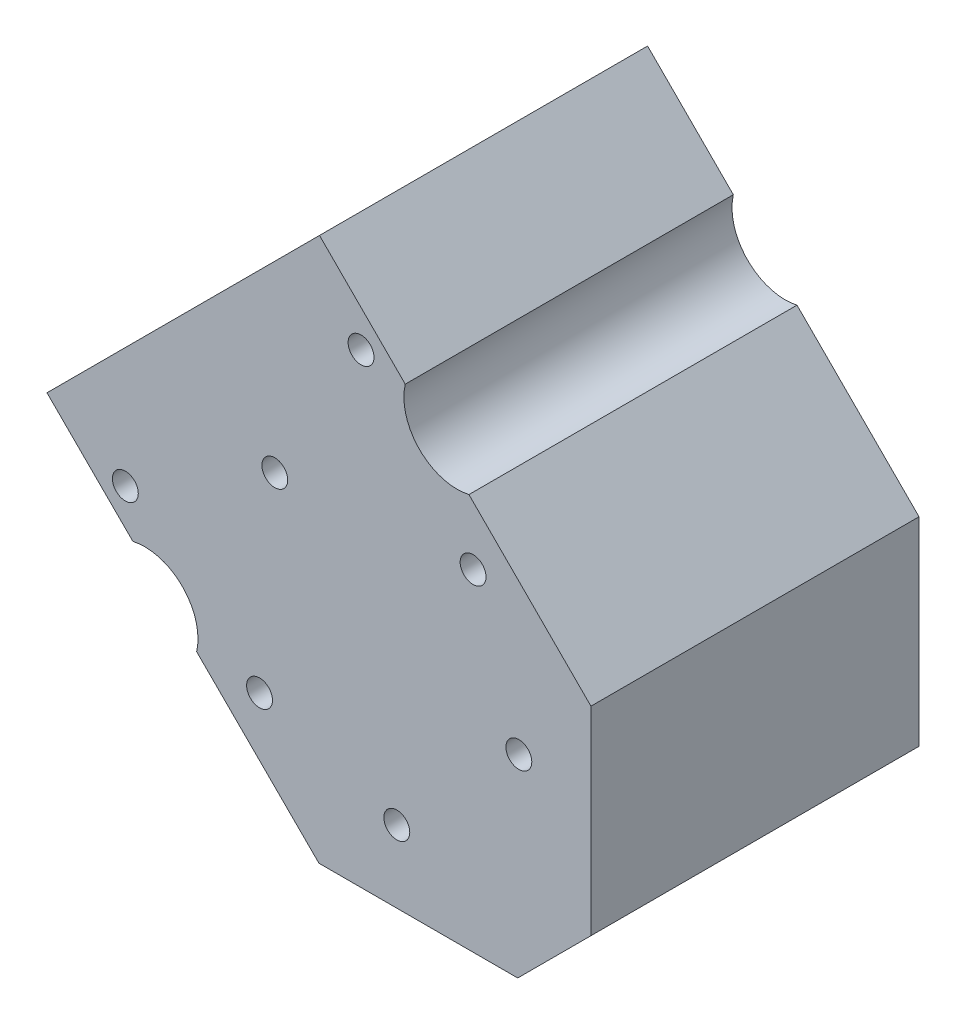
from build123d import *

# Parameters (mm, degrees)
BOSS_EXTRUDE1_DEPTH = 38.0226
SKETCH4_R           = 1.5
CUT_EXTRUDE2_DEPTH  = 133.893603459


with BuildPart() as part:
    # Sketch1 → Boss-Extrude1 (new body)
    with BuildSketch(Plane.XY):
        with BuildLine():
            Line((-58.458365937, 90.041634063), (-90.041634063, 58.458365937))
            Line((-90.041634063, 58.458365937), (-80.085733054, 48.520837101))
            ThreePointArc((-80.085733054, 48.520837101), (-74.352118178, 46.871638295), (-72.692331868, 41.141079365))
            Line((-72.692331868, 41.141079365), (-58.525108947, 27))
            Line((-58.525108947, 27), (-35.485281374, 27))
            Line((-35.485281374, 27), (-27, 35.485281374))
            Line((-27, 35.485281374), (-27, 58.525108947))
            Line((-27, 58.525108947), (-41.141079365, 72.692331868))
            ThreePointArc((-41.141079365, 72.692331868), (-46.871638295, 74.352118178), (-48.520837101, 80.085733054))
            Line((-48.520837101, 80.085733054), (-58.458365937, 90.041634063))
        make_face()
    extrude(amount=BOSS_EXTRUDE1_DEPTH)

    # Sketch4 → Cut-Extrude2 (cut, through all)
    with BuildSketch(Plane.XY.offset(38.0226)):
        with Locations((-63.639610307, 63.639610307)):
            Circle(SKETCH4_R)
        with Locations((-80.960118382, 53.639610307)):
            Circle(SKETCH4_R)
        with Locations((-53.639610307, 80.960118382)):
            Circle(SKETCH4_R)
        with Locations((-40.658639918, 65.40737726)):
            Circle(SKETCH4_R)
        with Locations((-65.40737726, 40.658639918)):
            Circle(SKETCH4_R)
        with Locations((-49.497474683, 35.355339059)):
            Circle(SKETCH4_R)
        with Locations((-35.355339059, 49.497474683)):
            Circle(SKETCH4_R)
    extrude(amount=-CUT_EXTRUDE2_DEPTH, mode=Mode.SUBTRACT)


solid = part.part
